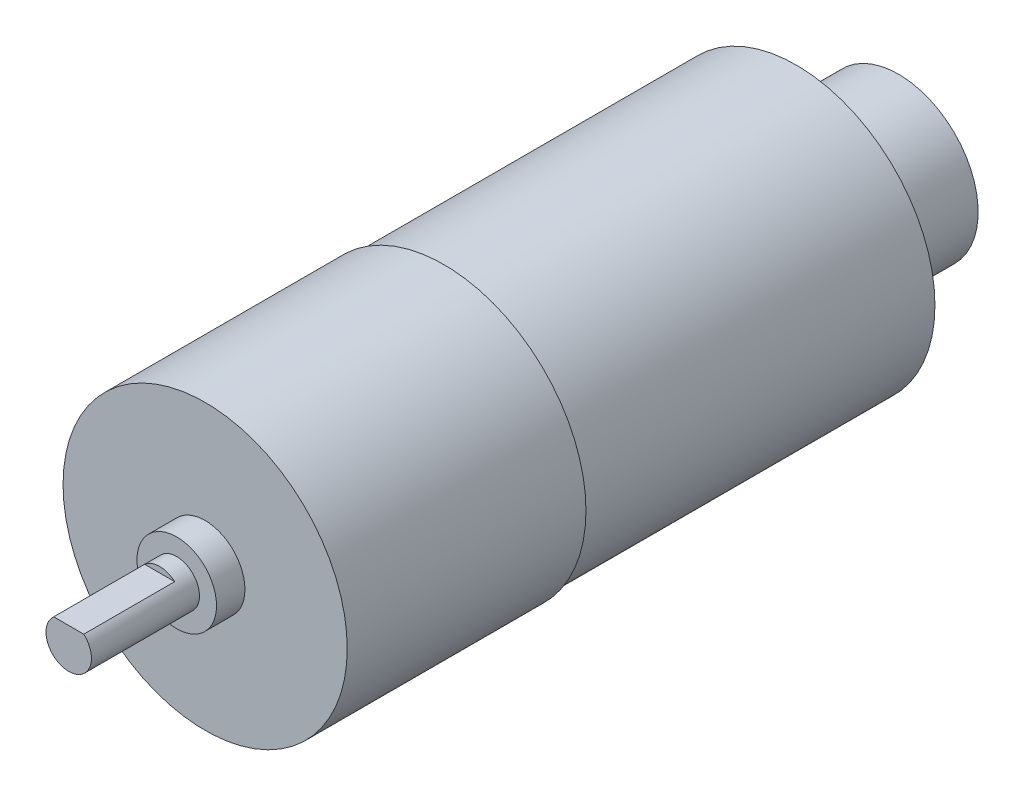
from build123d import *

# Parameters (mm, degrees)
SKETCH1_R           = 12.2
BOSS_EXTRUDE1_DEPTH = 31
SKETCH2_R           = 12.5
BOSS_EXTRUDE2_DEPTH = 21
SKETCH3_R           = 3.5
BOSS_EXTRUDE3_DEPTH = 2.5
SKETCH4_R           = 2
BOSS_EXTRUDE5_DEPTH = 1.5
BOSS_EXTRUDE6_DEPTH = 8
SKETCH6_R           = 0.5
BOSS_EXTRUDE7_DEPTH = 1
SKETCH7_R           = 7
BOSS_EXTRUDE8_DEPTH = 8


with BuildPart() as part:
    # Sketch1 → Boss-Extrude1 (new body)
    with BuildSketch(Plane.XY):
        Circle(SKETCH1_R)
    extrude(amount=BOSS_EXTRUDE1_DEPTH)

    # Sketch2 → Boss-Extrude2 (add)
    with BuildSketch(Plane.XY.offset(31)):
        with Locations(Location((0, 0, 0), (0, 0, 180))):
            Circle(SKETCH2_R)
    extrude(amount=BOSS_EXTRUDE2_DEPTH)

    # Sketch3 → Boss-Extrude3 (add)
    with BuildSketch(Plane.XY.offset(52)):
        Circle(SKETCH3_R)
    extrude(amount=BOSS_EXTRUDE3_DEPTH)

    # Sketch4 → Boss-Extrude5 (add)
    with BuildSketch(Plane.XY.offset(54.5)):
        Circle(SKETCH4_R)
    extrude(amount=BOSS_EXTRUDE5_DEPTH)

    # Sketch5 → Boss-Extrude6 (add)
    with BuildSketch(Plane.XY.offset(56)):
        with BuildLine():
            Line((0, 1.5), (1.322875656, 1.5))
            ThreePointArc((1.322875656, 1.5), (0, -2), (-1.322875656, 1.5))
            Line((-1.322875656, 1.5), (0, 1.5))
        make_face()
    extrude(amount=BOSS_EXTRUDE6_DEPTH)

    # Sketch6 → Boss-Extrude7 (add)
    with BuildSketch(Plane(origin=(0, 0, 0), x_dir=(-1, 0, 0), z_dir=(0, 0, -1))):
        with Locations(Location((0, 0, 0), (0, 0, 180))):
            Circle(SKETCH6_R)
    extrude(amount=BOSS_EXTRUDE7_DEPTH)

    # Sketch7 → Boss-Extrude8 (add)
    with BuildSketch(Plane(origin=(0, 0, -1), x_dir=(-1, 0, 0), z_dir=(0, 0, -1))):
        Circle(SKETCH7_R)
    extrude(amount=BOSS_EXTRUDE8_DEPTH)


solid = part.part
